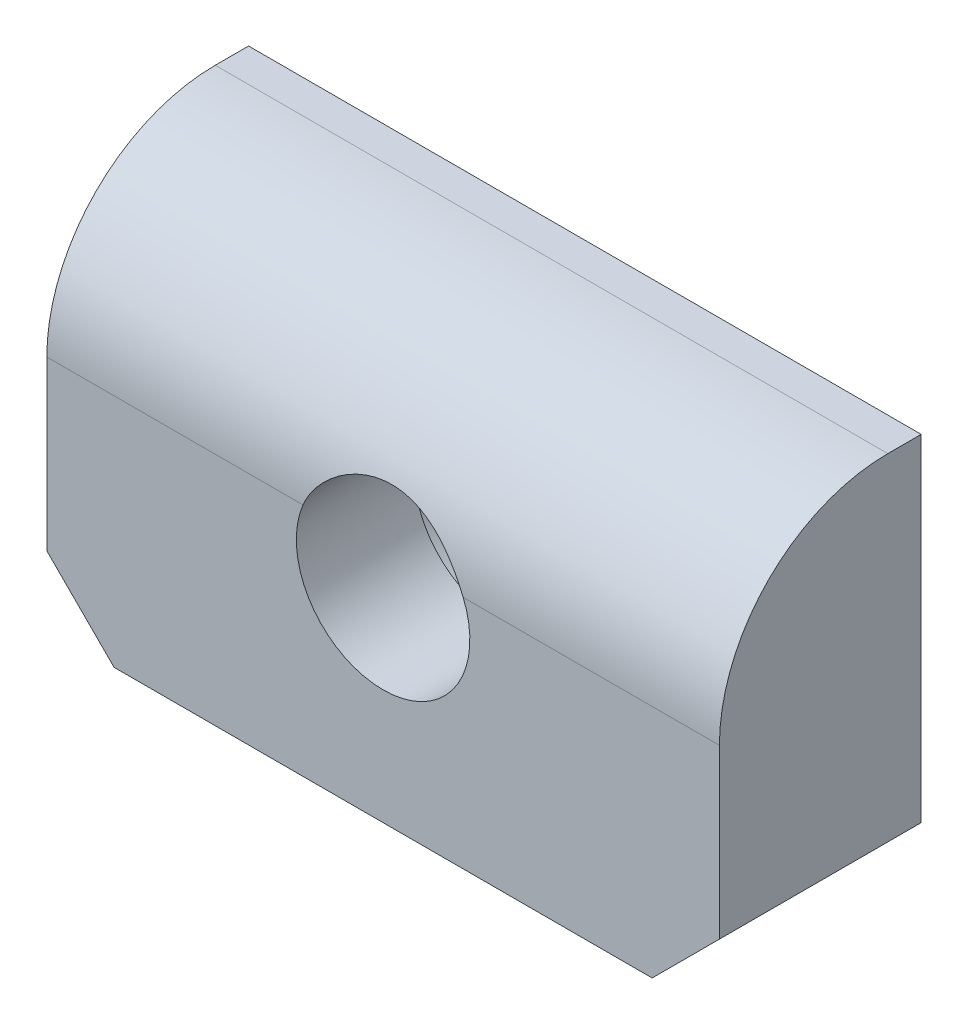
from build123d import *

# Parameters (mm, degrees)
BOSS_EXTRUDE2_DEPTH = 15.875
CHAMFER1_SIZE       = 3.175


with BuildPart() as part:
    # Sketch3 → Boss-Extrude2 (new, symmetric)
    with BuildSketch(Plane(origin=(0, 0, 0), x_dir=(0, 0, -1), z_dir=(1, 0, 0))):
        with BuildLine():
            ThreePointArc((3.1877, 9.525), (-2.433940332, 7.196440332), (-4.7625, 1.5748))
            Line((-4.7625, 1.5748), (-4.7625, -9.525))
            Line((-4.7625, -9.525), (4.7625, -9.525))
            Line((4.7625, -9.525), (4.7625, 9.525))
            Line((4.7625, 9.525), (3.1877, 9.525))
        make_face()
    extrude(amount=BOSS_EXTRUDE2_DEPTH, both=True)

    # Chamfer1
    chamfer1_edges = [part.edges().sort_by_distance(p)[0] for p in [
        (15.875, -9.525, 0),
        (-15.875, -9.525, 0),
    ]]
    chamfer(chamfer1_edges, length=CHAMFER1_SIZE)

    # Sketch4 → Cut-Revolve2 (revolve, cut)
    with BuildSketch(Plane(origin=(0, 0, 0), x_dir=(0, 0, -1), z_dir=(1, 0, 0)), mode=Mode.PRIVATE) as cut_revolve2_sk:
        Polygon((-4.7625, 4.09575), (0.8001, 4.09575), (0.8001, 5.6769), (4.7625, 5.6769), (4.7625, 0), (-4.7625, 0), align=None)
    revolve(cut_revolve2_sk.sketch.rotate(Axis((0, 0, 4.7625), (0, 0, -1)), 180), axis=Axis((0, 0, 4.7625), (0, 0, -1)), mode=Mode.SUBTRACT)


solid = part.part
